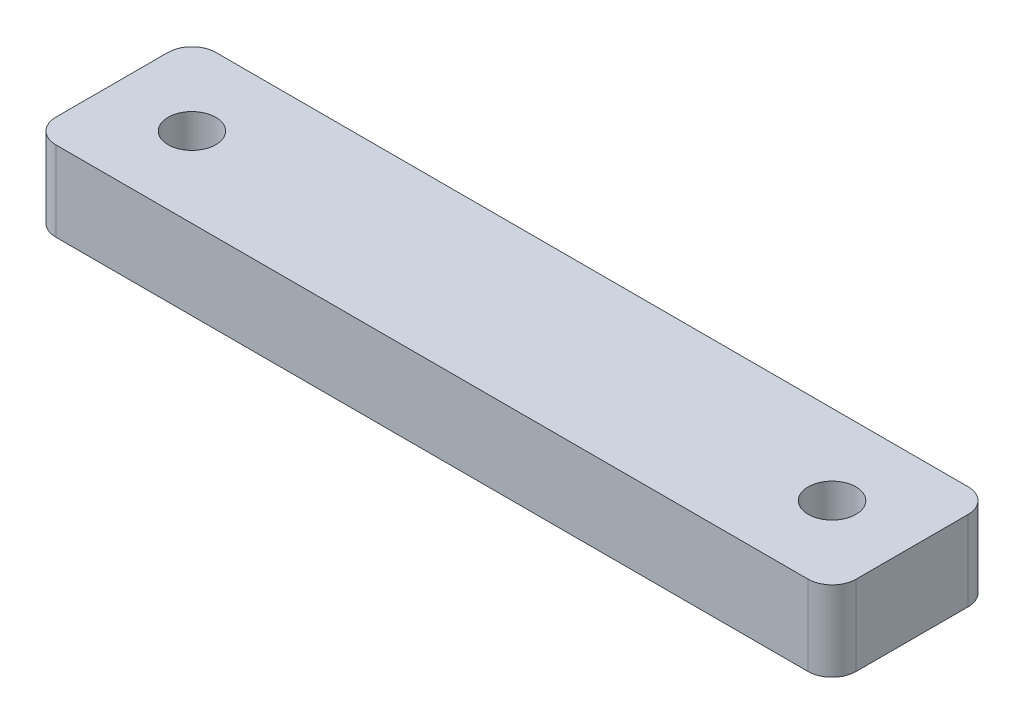
from build123d import *

# Parameters (mm, degrees)
SKETCH1_R           = 3.78198097
SKETCH1_R_2         = 3.790926472
BOSS_EXTRUDE1_DEPTH = 12.7


with BuildPart() as part:
    # Sketch1 → Boss-Extrude1 (new body)
    with BuildSketch(Plane(origin=(0, 0, 0), x_dir=(1, 0, 0), z_dir=(0, 1, 0))):
        with BuildLine():
            Line((3.81, 0), (123.19, 0))
            ThreePointArc((123.19, 0), (125.884076836, 1.115923164), (127, 3.81))
            Line((127, 3.81), (127, 21.59))
            ThreePointArc((127, 21.59), (125.884076836, 24.284076836), (123.19, 25.4))
            Line((123.19, 25.4), (3.81, 25.4))
            ThreePointArc((3.81, 25.4), (1.115923164, 24.284076836), (0, 21.59))
            Line((0, 21.59), (0, 3.81))
            ThreePointArc((0, 3.81), (1.115923164, 1.115923164), (3.81, 0))
        make_face()
        with Locations(Location((12.7, 12.7, 0), (0, 0, 270))):
            Circle(SKETCH1_R, mode=Mode.SUBTRACT)
        with Locations(Location((114.3, 12.7, 0), (0, 0, 270))):
            Circle(SKETCH1_R_2, mode=Mode.SUBTRACT)
    extrude(amount=BOSS_EXTRUDE1_DEPTH)


solid = part.part
